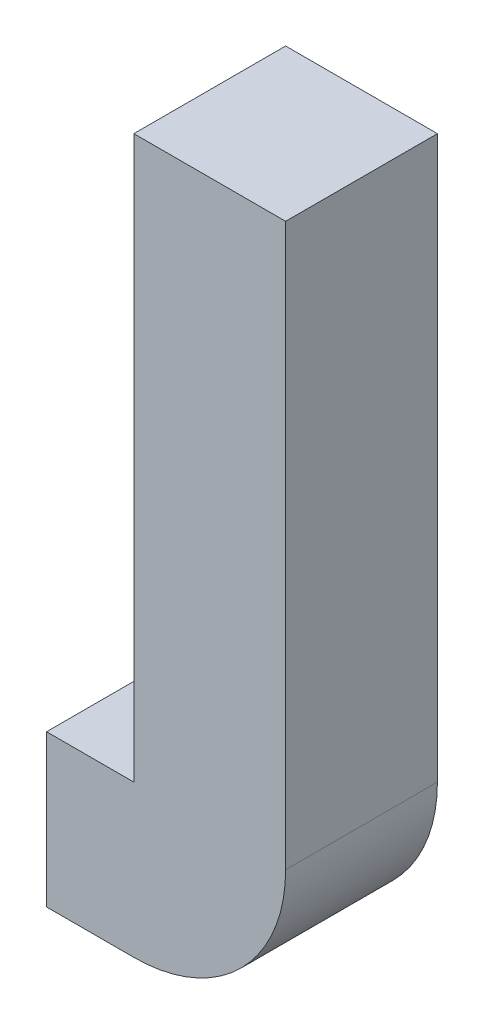
from build123d import *

# Parameters (mm, degrees)
SKETCH1_W   = 38.1
SKETCH1_H   = 38.1
SKETCH1_W_2 = 31.75
SKETCH1_H_2 = 31.75
SKETCH3_W   = 31.75
SKETCH3_H   = 31.75


with BuildPart() as part:
    # Sweep1: sweep along a path in Sketch2
    with BuildLine(Plane.XY) as sweep1_path:
        Line((40.95, 179.05), (40.95, 38.1))
        ThreePointArc((40.95, 38.1), (35.370384182, 24.629615818), (21.9, 19.05))
        Line((21.9, 19.05), (0, 19.05))
    # Sketch1 → Sweep1 (sweep)
    with BuildSketch(Plane(origin=(0, 0, 0), x_dir=(0, 0, -1), z_dir=(1, 0, 0))):
        with Locations((19.05, 19.05)):
            Rectangle(SKETCH1_W, SKETCH1_H)
        with Locations((19.05, 19.05)):
            Rectangle(SKETCH1_W_2, SKETCH1_H_2, mode=Mode.SUBTRACT)
    sweep(path=sweep1_path.line)

    # Sweep2: sweep along a path in Sketch2<2>
    with BuildLine(Plane.XY) as sweep2_path:
        Line((40.95, 179.05), (40.95, 38.1))
        ThreePointArc((40.95, 38.1), (35.370384182, 24.629615818), (21.9, 19.05))
        Line((21.9, 19.05), (0, 19.05))
    # Sketch3 → Sweep2 (sweep)
    with BuildSketch(Plane(origin=(0, 179.05, 0), x_dir=(1, 0, 0), z_dir=(0, 1, 0))):
        with Locations((40.95, 19.05)):
            Rectangle(SKETCH3_W, SKETCH3_H)
    sweep(path=sweep2_path.line)


solid = part.part
